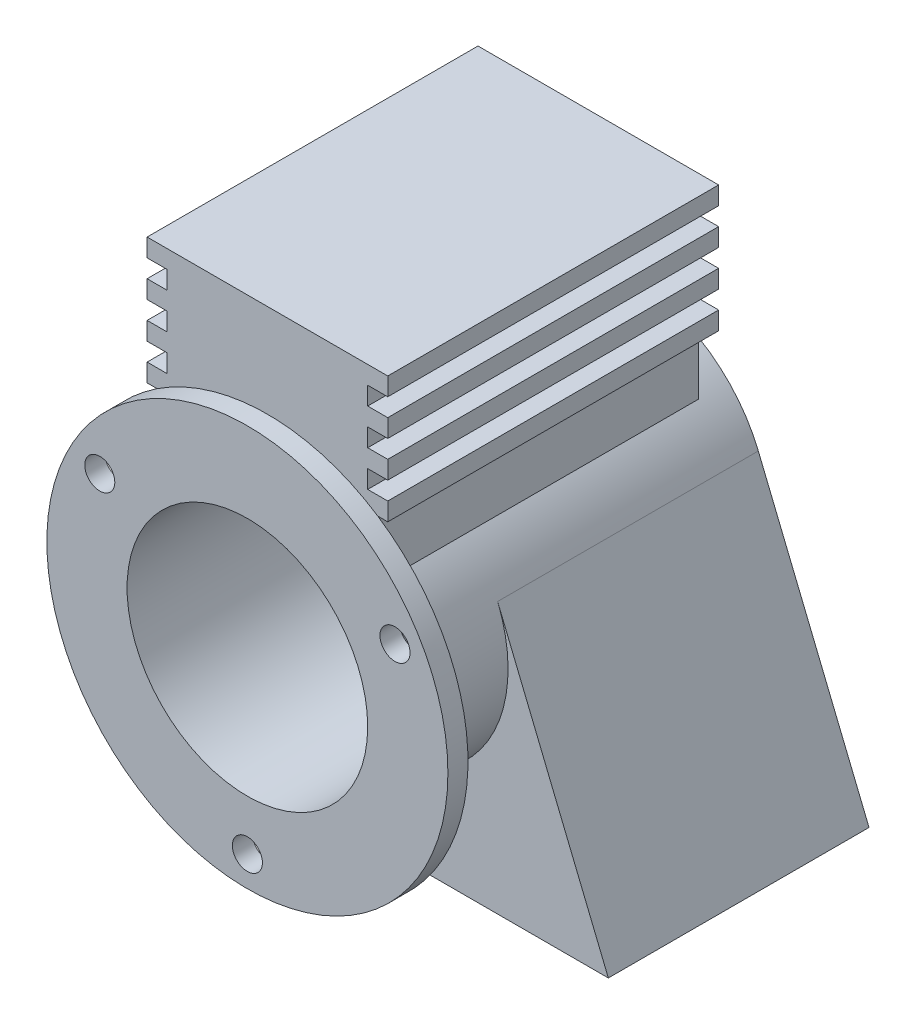
from build123d import *
from build123d.topology import SkipClean

# Parameters (mm, degrees)
BOSS_EXTRUDE1_DEPTH = 165.1
SKETCH2_R           = 88.9
BOSS_EXTRUDE2_DEPTH = 63.5
SKETCH3_R           = 127
BOSS_EXTRUDE3_DEPTH = 12.7
BOSS_EXTRUDE4_DEPTH = 209.55
SKETCH6_R           = 76.2
CUT_EXTRUDE1_DEPTH  = 228.6
CUT_EXTRUDE2_REACH  = 433.66
SKETCH7_R           = 19.05
CUT_EXTRUDE3_REACH  = 433.66
SKETCH9_R           = 9.525
CIRPATTERN1_COUNT   = 3


with BuildPart() as part:
    # Sketch1 → Boss-Extrude1 (new body)
    with BuildSketch(Plane.XY):
        with BuildLine():
            Line((-152.4, 0), (152.4, 0))
            Line((152.4, 0), (82.285119295, 171.45))
            ThreePointArc((82.285119295, 171.45), (0, 226.699306951), (-82.285119295, 171.45))
            Line((-82.285119295, 171.45), (-152.4, 0))
        make_face()
    extrude(amount=BOSS_EXTRUDE1_DEPTH)

    # Sketch2 → Boss-Extrude2 (add)
    with BuildSketch(Plane.XY.offset(165.1)):
        with Locations(Location((0, 137.799306951, 0), (0, 0, 157.757777303))):
            Circle(SKETCH2_R)
    extrude(amount=BOSS_EXTRUDE2_DEPTH)

    # Sketch3 → Boss-Extrude3 (add)
    with BuildSketch(Plane.XY.offset(228.6)):
        with Locations((0, 137.799306951)):
            Circle(SKETCH3_R)
    extrude(amount=BOSS_EXTRUDE3_DEPTH)

    # Sketch4 → Boss-Extrude4 (add)
    with SkipClean():  # the faces are left unmerged after this step: merging them gives an invalid solid
        with BuildSketch(Plane(origin=(0, 0, 19.05), x_dir=(-1, 0, 0), z_dir=(0, 0, -1))):
            with BuildLine():
                Line((-63.5, 189.570098967), (-63.5, 243.84))
                Line((-63.5, 243.84), (-76.2, 243.84))
                Line((-76.2, 243.84), (-76.2, 255.27))
                Line((-76.2, 255.27), (-63.5, 255.27))
                Line((-63.5, 255.27), (-63.5, 266.7))
                Line((-63.5, 266.7), (-76.2, 266.7))
                Line((-76.2, 266.7), (-76.2, 278.13))
                Line((-76.2, 278.13), (-63.5, 278.13))
                Line((-63.5, 278.13), (-63.5, 289.56))
                Line((-63.5, 289.56), (-76.2, 289.56))
                Line((-76.2, 289.56), (-76.2, 300.99))
                Line((-76.2, 300.99), (-63.5, 300.99))
                Line((-63.5, 300.99), (-63.5, 312.42))
                Line((-63.5, 312.42), (-76.2, 312.42))
                Line((-76.2, 312.42), (-76.2, 323.85))
                Line((-76.2, 323.85), (76.2, 323.85))
                Line((76.2, 323.85), (76.2, 312.42))
                Line((76.2, 312.42), (63.5, 312.42))
                Line((63.5, 312.42), (63.5, 300.99))
                Line((63.5, 300.99), (76.2, 300.99))
                Line((76.2, 300.99), (76.2, 289.56))
                Line((76.2, 289.56), (63.5, 289.56))
                Line((63.5, 289.56), (63.5, 278.13))
                Line((63.5, 278.13), (76.2, 278.13))
                Line((76.2, 278.13), (76.2, 266.7))
                Line((76.2, 266.7), (63.5, 266.7))
                Line((63.5, 266.7), (63.5, 255.27))
                Line((63.5, 255.27), (76.2, 255.27))
                Line((76.2, 255.27), (76.2, 243.84))
                Line((76.2, 243.84), (63.5, 243.84))
                Line((63.5, 243.84), (63.5, 189.570098967))
                ThreePointArc((63.5, 189.570098967), (0, 219.728940821), (-63.5, 189.570098967))
            make_face()
        extrude(amount=-BOSS_EXTRUDE4_DEPTH)

    # Sketch6 → Cut-Extrude1 (cut)
    with SkipClean():  # the faces are left unmerged after this step: merging them gives an invalid solid
        with BuildSketch(Plane.XY.offset(241.3)):
            with Locations((0, 137.799306951)):
                Circle(SKETCH6_R)
        extrude(amount=-CUT_EXTRUDE1_DEPTH, mode=Mode.SUBTRACT)

    # Sketch7 → Cut-Extrude2 (cut, up to next)
    with BuildSketch(Plane(origin=(0, 0, 0), x_dir=(-1, 0, 0), z_dir=(0, 0, -1)), mode=Mode.PRIVATE) as cut_extrude2_sk1:
        with Locations((0, 137.799306951)):
            Circle(SKETCH7_R)
    cut_extrude2_tool1 = extrude(cut_extrude2_sk1.sketch, amount=-CUT_EXTRUDE2_REACH, mode=Mode.PRIVATE) & part.part
    add(cut_extrude2_tool1.solids().sort_by_distance((0, 137.799307, 0))[0], mode=Mode.SUBTRACT)

    # Sketch9 → Cut-Extrude3 (cut, up to next)
    with BuildSketch(Plane.XY.offset(241.3), mode=Mode.PRIVATE) as cut_extrude3_sk1:
        with Locations((0, 29.849306951)):
            Circle(SKETCH9_R)
    cut_extrude3_tool1 = extrude(cut_extrude3_sk1.sketch, amount=-CUT_EXTRUDE3_REACH, mode=Mode.PRIVATE) & part.part
    cut_extrude3 = cut_extrude3_tool1.solids().sort_by_distance((0, 29.849307, 241.3))[0]
    add(cut_extrude3, mode=Mode.SUBTRACT)

    # CirPattern1: Cut-Extrude3 ×3 about axis
    with SkipClean():  # the faces are left unmerged after this step: merging them gives an invalid solid
        cirpattern1_axis = Axis((0, 137.799306951, 0), (0, 0, 1))
        for i in range(1, CIRPATTERN1_COUNT):
            add(cut_extrude3.rotate(cirpattern1_axis, i * 360 / CIRPATTERN1_COUNT), mode=Mode.SUBTRACT)


solid = part.part
